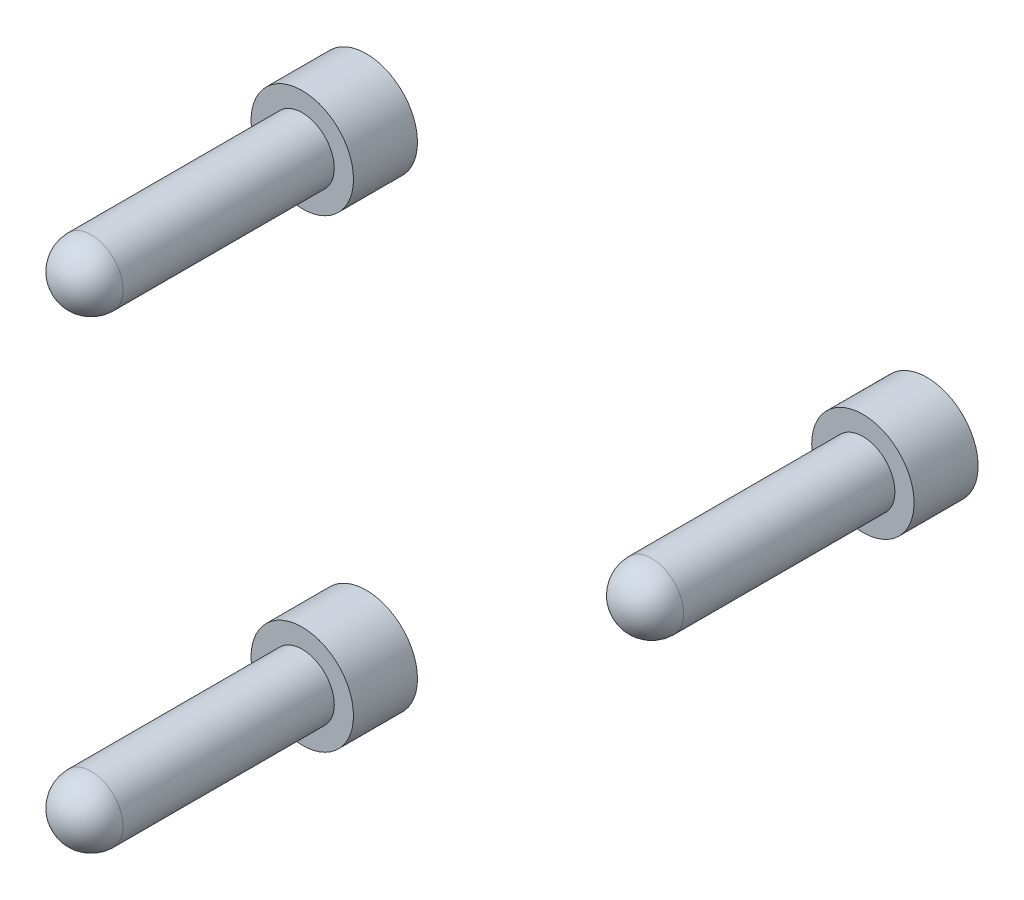
from build123d import *

# Parameters (mm, degrees)
SKETCH_1_R        = 4
EXTRUDE_1_DEPTH   = 5
EXTRUDE_1_2_DEPTH = 5
EXTRUDE_1_3_DEPTH = 5
SKETCH_2_R        = 2.5
EXTRUDE_2_DEPTH   = 19
FILLET_4_R        = 2.5
FILLET_5_R        = 2.5
FILLET_6_R        = 2.5


with BuildPart() as part:
    # 草圖1 → 填料-伸長1 (new body)
    with BuildSketch(Plane.XY):
        with Locations((-21.9, 16.9)):
            Circle(SKETCH_1_R)
    extrude(amount=EXTRUDE_1_DEPTH)



with BuildPart() as body_2:
    # 草圖1 → Extrude 1 2 (new body)
    with BuildSketch(Plane.XY):
        with Locations((-21.9, -19.4)):
            Circle(SKETCH_1_R)
    extrude(amount=EXTRUDE_1_2_DEPTH)


with BuildPart() as body_3:
    # 草圖1 → Extrude 1 3 (new body)
    with BuildSketch(Plane.XY):
        with Locations(Location((21.9, 16.9, 0), (0, 0, 180))):
            Circle(SKETCH_1_R)
    extrude(amount=EXTRUDE_1_3_DEPTH)


with BuildPart() as part_1:
    add(part.part)

    add(body_2.part)  # 填料-伸長2 merges body 2

    add(body_3.part)  # 填料-伸長2 merges body 3
    # 草圖2 → 填料-伸長2 (add)
    with BuildSketch(Plane.XY.offset(5)):
        with Locations((-21.9, 16.9)):
            Circle(SKETCH_2_R)
        with Locations((21.9, 16.9)):
            Circle(SKETCH_2_R)
        with Locations((-21.9, -19.4)):
            Circle(SKETCH_2_R)
    extrude(amount=EXTRUDE_2_DEPTH)

    # 圓角4
    fillet_4_edges = [part_1.edges().sort_by_distance(p)[0] for p in [
        (-24.4, 16.9, 24),
    ]]
    fillet(fillet_4_edges, radius=FILLET_4_R)

    # 圓角5
    fillet_5_edges = [part_1.edges().sort_by_distance(p)[0] for p in [
        (-24.4, -19.4, 24),
    ]]
    fillet(fillet_5_edges, radius=FILLET_5_R)

    # 圓角6
    fillet_6_edges = [part_1.edges().sort_by_distance(p)[0] for p in [
        (19.4, 16.9, 24),
    ]]
    fillet(fillet_6_edges, radius=FILLET_6_R)


solid = part_1.part
